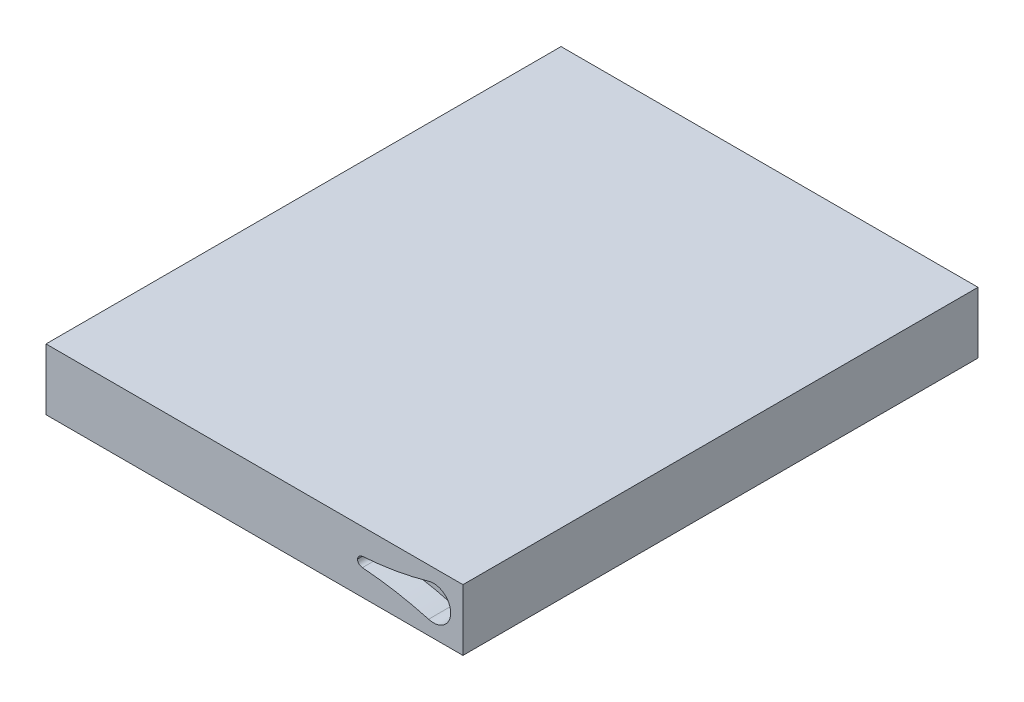
from build123d import *

# Parameters (mm, degrees)
SKETCH1_W           = 80
SKETCH1_H           = 105
SKETCH1_W_2         = 5
BOSS_EXTRUDE1_DEPTH = 12.5
CUT_EXTRUDE1_DEPTH  = 5


with BuildPart() as part:
    # Sketch1 → Boss-Extrude1 (new body)
    with BuildSketch(Plane(origin=(0, 0, 0), x_dir=(1, 0, 0), z_dir=(0, 1, 0))):
        with Locations((40, 52.5)):
            Rectangle(SKETCH1_W, SKETCH1_H)
        with Locations((-2.5, 52.5)):
            Rectangle(SKETCH1_W_2, SKETCH1_H)
    extrude(amount=BOSS_EXTRUDE1_DEPTH)

    # Sketch2 → Cut-Extrude1 (cut)
    with BuildSketch(Plane.XY):
        with BuildLine():
            ThreePointArc((73, 2.895898034), (76.091650066, 3.44375696), (77.5, 6.25))
            Line((77.5, 6.25), (74, 6.25))
            Line((74, 6.25), (73, 6.25))
            Line((73, 6.25), (73, 2.895898034))
        make_face()
        with BuildLine():
            Line((74, 6.25), (77.5, 6.25))
            ThreePointArc((77.5, 6.25), (76.091650066, 9.05624304), (73, 9.604101966))
            Line((73, 9.604101966), (73, 6.25))
            Line((73, 6.25), (74, 6.25))
        make_face()
        with BuildLine():
            Line((73, 6.25), (73, 9.604101966))
            ThreePointArc((73, 9.604101966), (71.19375696, 8.341650066), (70.5, 6.25))
            Line((70.5, 6.25), (73, 6.25))
        make_face()
        with BuildLine():
            ThreePointArc((70.5, 6.25), (71.19375696, 4.158349934), (73, 2.895898034))
            Line((73, 2.895898034), (73, 6.25))
            Line((73, 6.25), (70.5, 6.25))
        make_face()
        with BuildLine():
            ThreePointArc((59.5, 5.25), (66.307499895, 4.402691993), (73, 2.895898034))
            ThreePointArc((73, 2.895898034), (71.19375696, 4.158349934), (70.5, 6.25))
            Line((70.5, 6.25), (59.5, 6.25))
            Line((59.5, 6.25), (58.5, 6.25))
            ThreePointArc((58.5, 6.25), (58.814539324, 5.564539324), (59.5, 5.25))
        make_face()
        with BuildLine():
            ThreePointArc((70.5, 6.25), (71.19375696, 8.341650066), (73, 9.604101966))
            ThreePointArc((73, 9.604101966), (66.311170081, 8.076260701), (59.5, 7.25))
            ThreePointArc((59.5, 7.25), (58.812768212, 6.937231788), (58.5, 6.25))
            Line((58.5, 6.25), (59.5, 6.25))
            Line((59.5, 6.25), (70.5, 6.25))
        make_face()
    extrude(amount=-CUT_EXTRUDE1_DEPTH, mode=Mode.SUBTRACT)


solid = part.part
